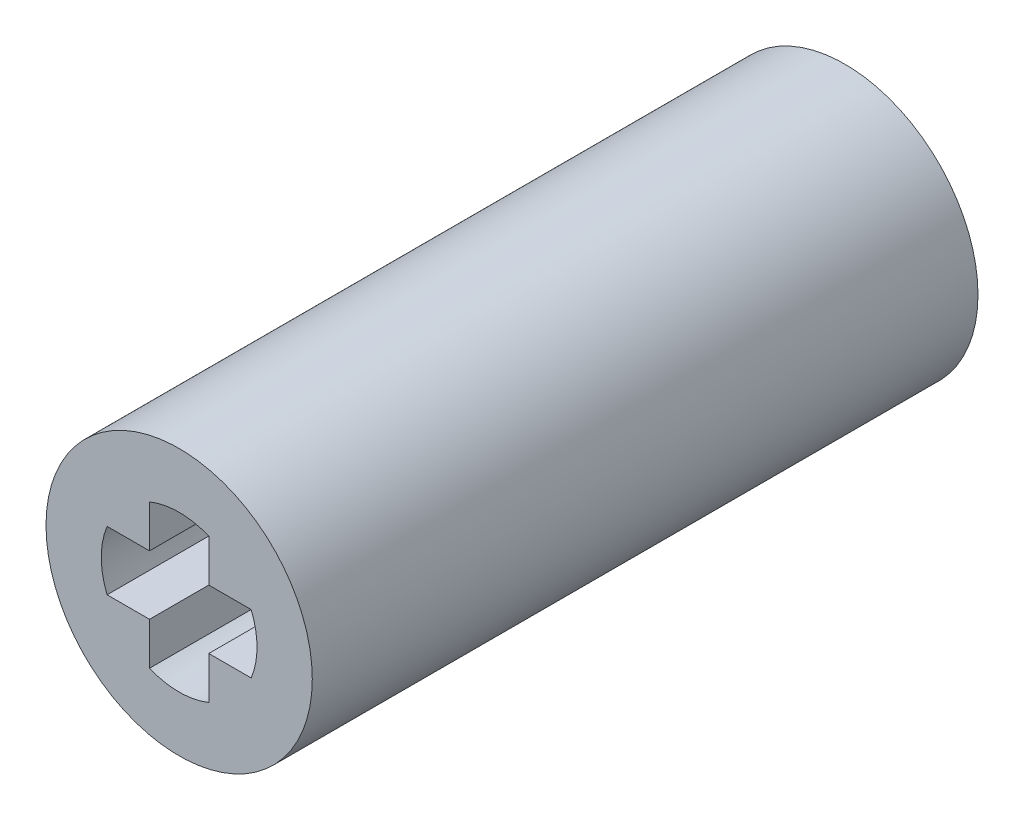
from build123d import *

# Parameters (mm, degrees)
SKETCH1_R           = 4
BOSS_EXTRUDE1_DEPTH = 10
BOSS_EXTRUDE2_START = -10
SKETCH1_3_R         = 4
BOSS_EXTRUDE2_DEPTH = 10


with BuildPart() as part:
    # Sketch1 → Boss-Extrude1 (new body)
    with BuildSketch(Plane.XY):
        Circle(SKETCH1_R)
        with BuildLine():
            ThreePointArc((-0.89, 2.164139552), (0, 2.34), (0.89, 2.164139552))
            Line((0.89, 2.164139552), (0.89, 0.89))
            Line((0.89, 0.89), (2.164139552, 0.89))
            ThreePointArc((2.164139552, 0.89), (2.34, 0), (2.164139552, -0.89))
            Line((2.164139552, -0.89), (0.89, -0.89))
            Line((0.89, -0.89), (0.89, -2.164139552))
            ThreePointArc((0.89, -2.164139552), (0, -2.34), (-0.89, -2.164139552))
            Line((-0.89, -2.164139552), (-0.89, -0.89))
            Line((-0.89, -0.89), (-2.164139552, -0.89))
            ThreePointArc((-2.164139552, -0.89), (-2.34, 0), (-2.164139552, 0.89))
            Line((-2.164139552, 0.89), (-0.89, 0.89))
            Line((-0.89, 0.89), (-0.89, 2.164139552))
        make_face(mode=Mode.SUBTRACT)
    extrude(amount=BOSS_EXTRUDE1_DEPTH)

    # Sketch1<3> → Boss-Extrude2 (add)
    with BuildSketch(Plane.XY.offset(BOSS_EXTRUDE2_START)):
        Circle(SKETCH1_3_R)
        with BuildLine():
            ThreePointArc((1.118033989, 1), (0, -1.5), (-1.118033989, 1))
            Line((-1.118033989, 1), (1.118033989, 1))
        make_face(mode=Mode.SUBTRACT)
    extrude(amount=BOSS_EXTRUDE2_DEPTH)


solid = part.part
